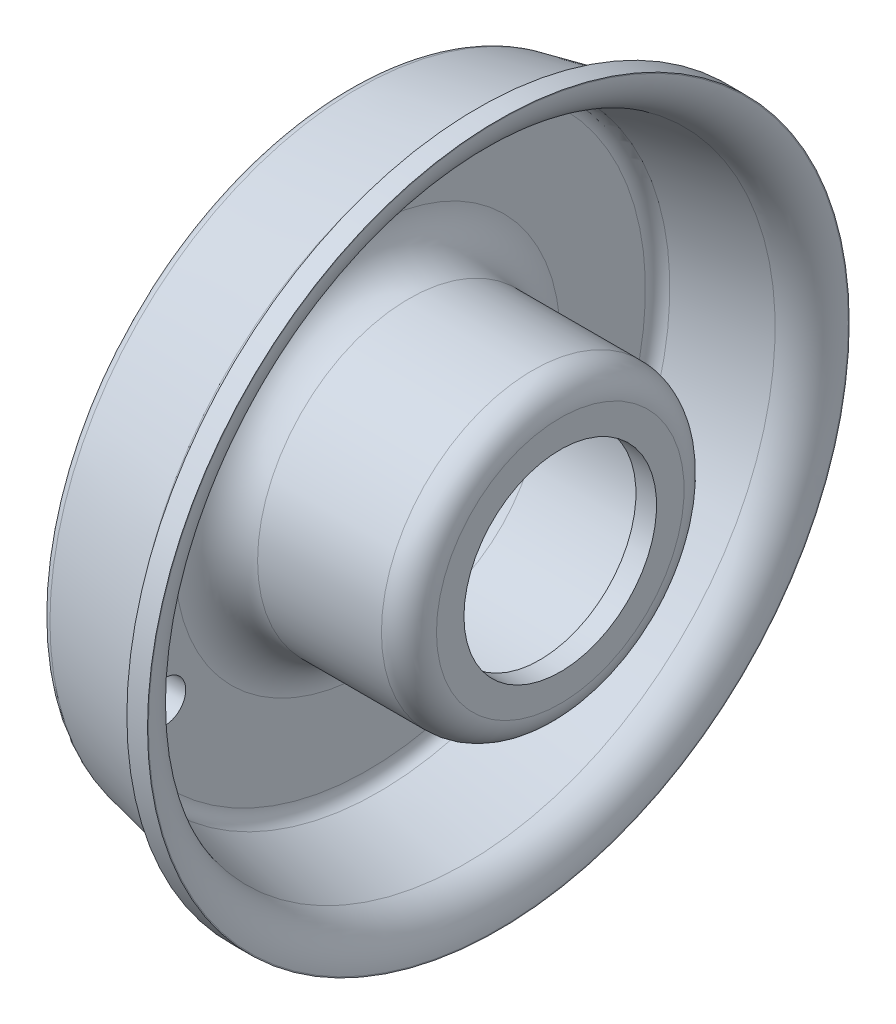
from build123d import *

# Parameters (mm, degrees)
SKETCH2_R          = 1.5
CUT_EXTRUDE2_DEPTH = 25


with BuildPart() as part:
    # Sketch1 → Revolve1 (revolve)
    with BuildSketch(Plane(origin=(0, 0, 0), x_dir=(1, 0, 0), z_dir=(0, 1, 0))):
        with BuildLine():
            Line((20, -11), (29, -11))
            ThreePointArc((29, -11), (30.414213562, -10.414213562), (31, -9))
            Line((31, -9), (31, -7))
            Line((31, -7), (29.5, -7))
            Line((29.5, -7), (29.5, -9))
            ThreePointArc((29.5, -9), (29.353553391, -9.353553391), (29, -9.5))
            Line((29, -9.5), (20, -9.5))
            ThreePointArc((20, -9.5), (16.818019485, -10.818019485), (15.5, -14))
            Line((15.5, -14), (15.5, -21.405697048))
            ThreePointArc((15.5, -21.405697048), (15.723465879, -22.03577225), (16.293989519, -22.384246833))
            Line((16.293989519, -22.384246833), (23.809015722, -23.966357613))
            ThreePointArc((23.809015722, -23.966357613), (24.664801181, -24.489069488), (25, -25.43418229))
            Line((25, -25.43418229), (25, -25.5))
            Line((25, -25.5), (26.5, -25.5))
            Line((26.5, -25.5), (26.5, -25.43418229))
            ThreePointArc((26.5, -25.43418229), (25.829602362, -23.543956686), (24.118031443, -22.498532935))
            Line((24.118031443, -22.498532935), (17.793989519, -21.167155688))
            ThreePointArc((17.793989519, -21.167155688), (17.223465879, -20.818681105), (17, -20.188605903))
            Line((17, -20.188605903), (17, -14))
            ThreePointArc((17, -14), (17.878679656, -11.878679656), (20, -11))
        make_face()
    revolve(axis=Axis((15.5, 0, 0), (1, 0, 0)))

    # Sketch2 → Cut-Extrude2 (cut)
    with BuildSketch(Plane(origin=(0, 0, 0), x_dir=(0, 0, -1), z_dir=(1, 0, 0))):
        with Locations(Location((0, 17, 0), (0, 0, 180))):
            Circle(SKETCH2_R)
        with Locations(Location((14.722431864, -8.5, 0), (0, 0, 180))):
            Circle(SKETCH2_R)
        with Locations(Location((-14.722431864, -8.5, 0), (0, 0, 180))):
            Circle(SKETCH2_R)
    extrude(amount=CUT_EXTRUDE2_DEPTH, mode=Mode.SUBTRACT)


solid = part.part
